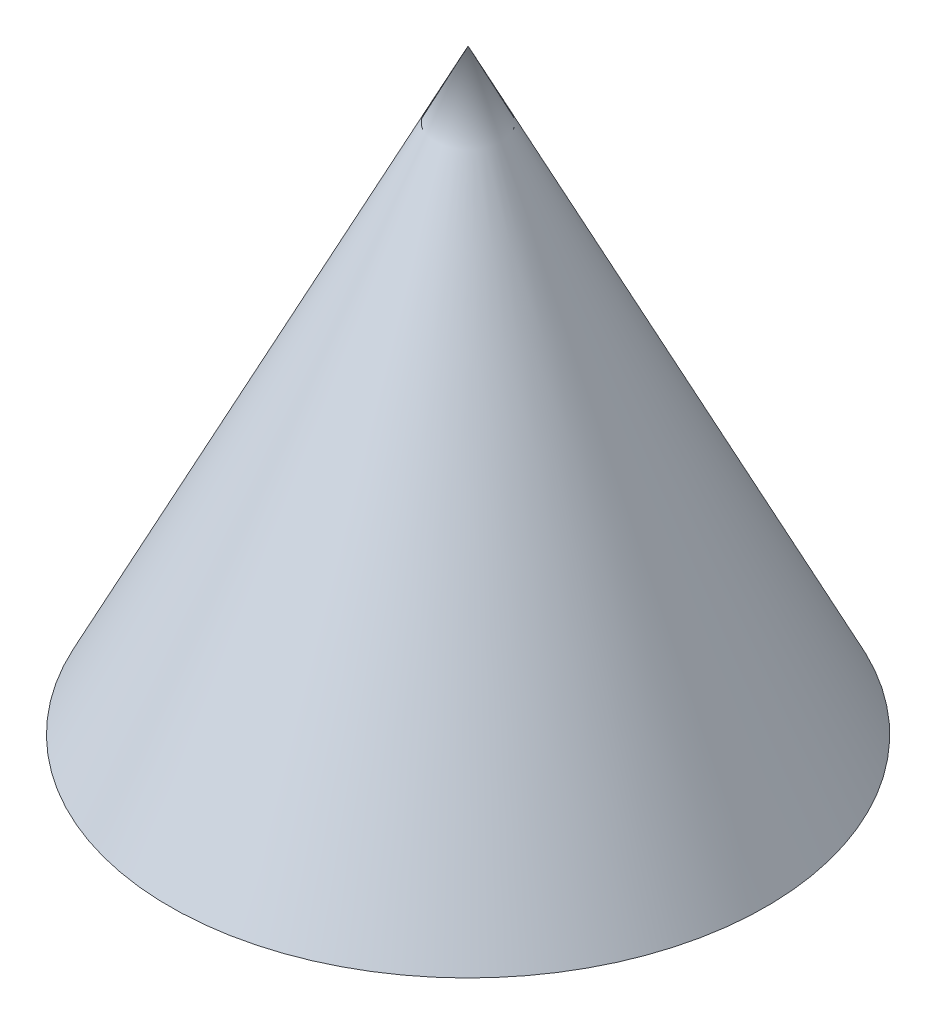
from build123d import *


with BuildPart() as part:
    # 草图1 → 旋转1 (revolve)
    with BuildSketch(Plane.XY, mode=Mode.PRIVATE) as revolve_1_sk:
        Polygon((0, 0), (50, 0), (0, 100), align=None)
    revolve(revolve_1_sk.sketch.rotate(Axis((0, 0, 0), (0, 1, 0)), 90), axis=Axis((0, 0, 0), (0, 1, 0)))


solid = part.part
